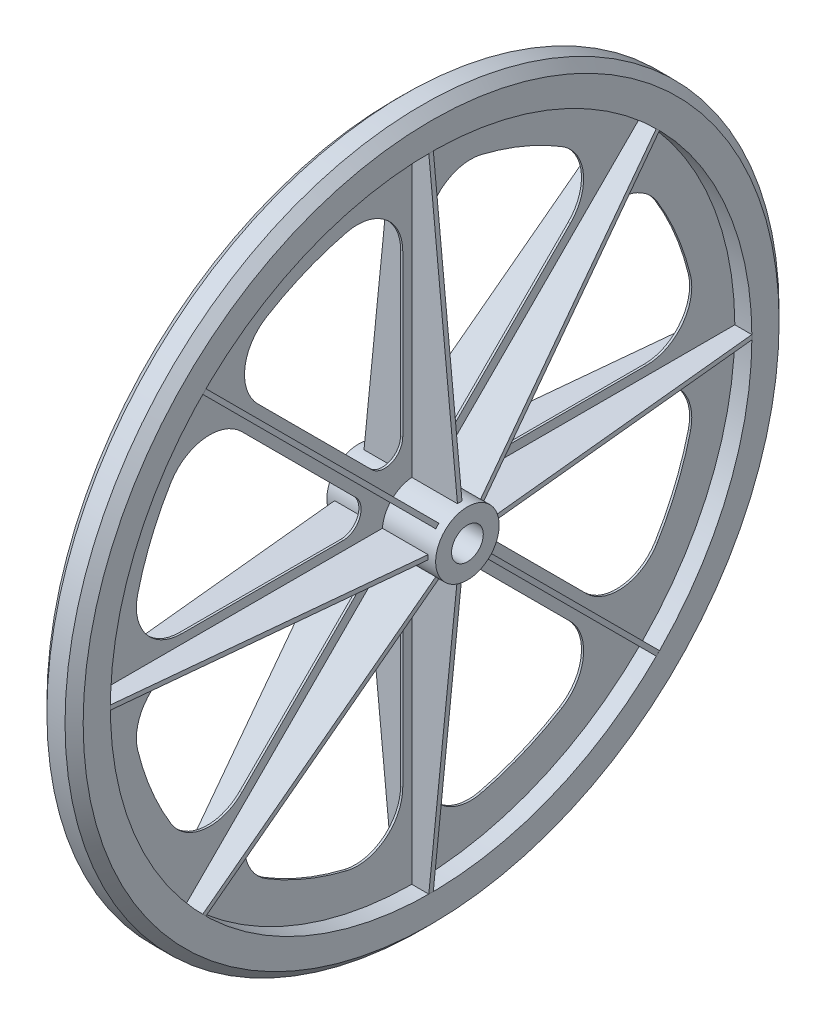
from build123d import *

# Parameters (mm, degrees)
BOSS_EXTRUDE1_DEPTH      = 38.1
BOSS_EXTRUDE1_DEPTH_BACK = 38.1
SKETCH1_R                = 22.225
BOSS_EXTRUDE2_DEPTH      = 0.762
BOSS_EXTRUDE2_DEPTH_BACK = 0.762
SKETCH2_R                = 250
BOSS_EXTRUDE3_DEPTH      = 12.7
BOSS_EXTRUDE3_DEPTH_BACK = 12.7
SKETCH3_R                = 250
SKETCH3_R_2              = 224.6
CUT_EXTRUDE1_DEPTH       = 356.600351518
CIRPATTERN1_COUNT        = 8
CUT_EXTRUDE2_DEPTH       = 356.600351529
CUT_EXTRUDE2_DEPTH_BACK  = 356.600351529
SKETCH9_R                = 11.1125
CHAMFER1_SIZE            = 6.35


with BuildPart() as part:
    # Sketch1 → Boss-Extrude1 (new, two sides: drawn at the far end of the back side and taken through both)
    with BuildSketch(Plane(origin=(0, 0, 0), x_dir=(0, 0, -1), z_dir=(1, 0, 0)).offset(-BOSS_EXTRUDE1_DEPTH_BACK)):
        Circle(SKETCH1_R)
    extrude(amount=BOSS_EXTRUDE1_DEPTH + BOSS_EXTRUDE1_DEPTH_BACK)

    # Sketch2 → Boss-Extrude2 (add, two sides: drawn at the far end of the back side and taken through both)
    with BuildSketch(Plane(origin=(0, 0, 0), x_dir=(0, 0, -1), z_dir=(1, 0, 0)).offset(-BOSS_EXTRUDE2_DEPTH_BACK)):
        Circle(SKETCH2_R)
    extrude(amount=BOSS_EXTRUDE2_DEPTH + BOSS_EXTRUDE2_DEPTH_BACK)

    # Sketch3 → Boss-Extrude3 (add, two sides: drawn at the far end of the back side and taken through both)
    with BuildSketch(Plane(origin=(0, 0, 0), x_dir=(0, 0, -1), z_dir=(1, 0, 0)).offset(-BOSS_EXTRUDE3_DEPTH_BACK)):
        Circle(SKETCH3_R)
        Circle(SKETCH3_R_2, mode=Mode.SUBTRACT)
    extrude(amount=BOSS_EXTRUDE3_DEPTH + BOSS_EXTRUDE3_DEPTH_BACK)

    # Sketch4 → Cut-Extrude1 (cut, symmetric)
    with BuildSketch(Plane(origin=(0, 0, 0), x_dir=(0, 0, -1), z_dir=(1, 0, 0))):
        with BuildLine():
            Line((109.41865054, 120.643970691), (29.617756121, 40.843076272))
            ThreePointArc((29.617756121, 40.843076272), (15.777420409, 38.090062331), (7.9375, 49.823332393))
            Line((7.9375, 49.823332393), (7.9375, 162.67883957))
            ThreePointArc((7.9375, 162.67883957), (20.077036589, 187.648665857), (47.212600776, 193.524185382))
            ThreePointArc((47.212600776, 193.524185382), (76.230539727, 184.036802876), (103.457913641, 170.226613974))
            ThreePointArc((103.457913641, 170.226613974), (118.49103539, 146.884252827), (109.41865054, 120.643970691))
        make_face()
    cut_extrude1 = extrude(amount=CUT_EXTRUDE1_DEPTH, both=True, mode=Mode.SUBTRACT)

    # Sketch5 → Loft1 section 0
    with BuildSketch(Plane(origin=(0, 0, 0), x_dir=(1, 0, 0), z_dir=(0, 1, 0))):
        with BuildLine():
            Line((-34.925, -1.5875), (34.925, -1.5875))
            Line((34.925, -1.5875), (34.925, 1.5875))
            Line((34.925, 1.5875), (-34.925, 1.5875))
            Line((-34.925, 1.5875), (-34.925, -1.5875))
        make_face()
    # Sketch6 → Loft1 section 1
    with BuildSketch(Plane(origin=(0, 240, 0), x_dir=(-1, 0, 0), z_dir=(0, 1, 0))):
        with BuildLine():
            Line((11.1125, 1.5875), (-11.1125, 1.5875))
            Line((-11.1125, 1.5875), (-11.1125, -1.5875))
            Line((-11.1125, -1.5875), (11.1125, -1.5875))
            Line((11.1125, -1.5875), (11.1125, 1.5875))
        make_face()
    loft1 = loft()

    # CirPattern1: Cut-Extrude1, Loft1 ×8 about axis
    cirpattern1_axis = Axis((-38.1, 0, 0), (1, 0, 0))
    add([cut_extrude1.rotate(cirpattern1_axis, i * 360 / CIRPATTERN1_COUNT) for i in range(1, CIRPATTERN1_COUNT)], mode=Mode.SUBTRACT)
    add([loft1.rotate(cirpattern1_axis, i * 360 / CIRPATTERN1_COUNT) for i in range(1, CIRPATTERN1_COUNT)])

    # Sketch9 → Cut-Extrude2 (cut, two sides: drawn at the far end of the back side and taken through both)
    with BuildSketch(Plane(origin=(0, 0, 0), x_dir=(0, 0, -1), z_dir=(1, 0, 0)).offset(-CUT_EXTRUDE2_DEPTH_BACK)):
        Circle(SKETCH9_R)
    extrude(amount=CUT_EXTRUDE2_DEPTH + CUT_EXTRUDE2_DEPTH_BACK, mode=Mode.SUBTRACT)

    # Chamfer1
    chamfer1_edges = [part.edges().sort_by_distance(p)[0] for p in [
        (-12.7, 0, 250),
        (12.7, 0, 250),
    ]]
    chamfer(chamfer1_edges, length=CHAMFER1_SIZE)


solid = part.part
